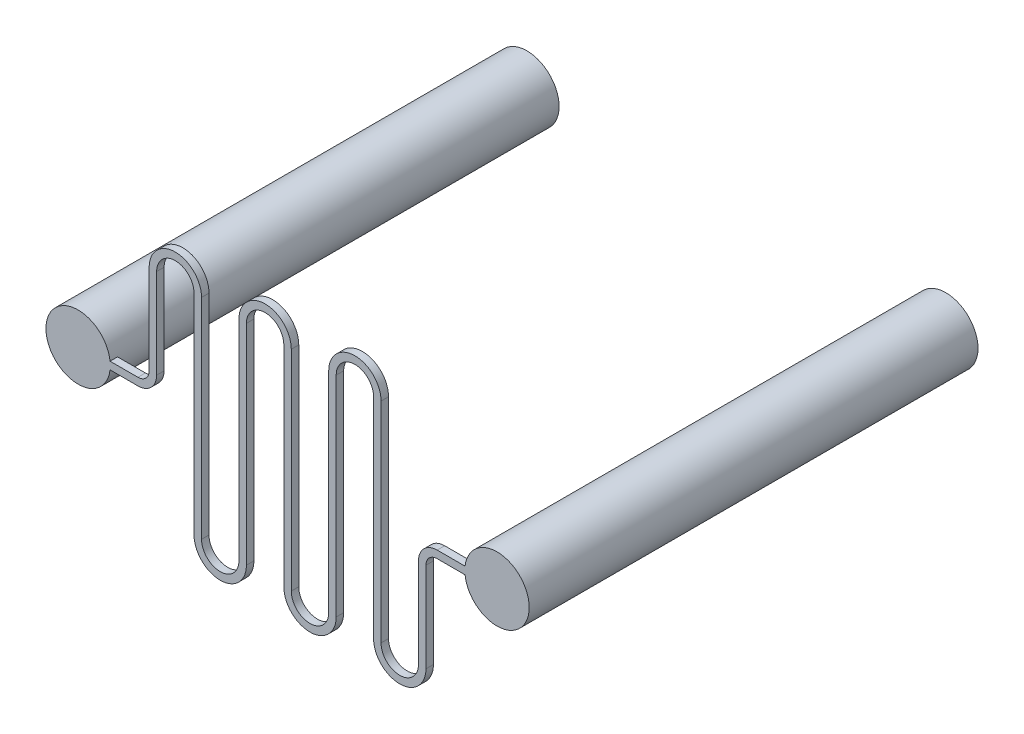
from build123d import *

# Parameters (mm, degrees)
BOSS_EXTRUDE1_DEPTH = 0.5
SKETCH3_W           = 2.15
SKETCH3_H           = 30
SKETCH4_W           = 2.15
SKETCH4_H           = 30
SKETCH5_R           = 1.75
CUT_EXTRUDE1_DEPTH  = 29


with BuildPart() as part:
    # Sketch2 → Boss-Extrude1 (new body)
    with BuildSketch(Plane.XY):
        with BuildLine():
            Line((-17.5, -0.25), (-13.5, -0.25))
            ThreePointArc((-13.5, -0.25), (-12.616116524, 0.116116524), (-12.25, 1))
            Line((-12.25, 1), (-12.25, 7))
            ThreePointArc((-12.25, 7), (-11, 8.25), (-9.75, 7))
            Line((-9.75, 7), (-9.75, 0))
            Line((-9.75, 0), (-9.75, -7))
            ThreePointArc((-9.75, -7), (-8, -8.75), (-6.25, -7))
            Line((-6.25, -7), (-6.25, 0))
            Line((-6.25, 0), (-6.25, 7))
            ThreePointArc((-6.25, 7), (-5, 8.25), (-3.75, 7))
            Line((-3.75, 7), (-3.75, 0))
            Line((-3.75, 0), (-3.75, -7))
            ThreePointArc((-3.75, -7), (-2, -8.75), (-0.25, -7))
            Line((-0.25, -7), (-0.25, 0))
            Line((-0.25, 0), (-0.25, 7))
            ThreePointArc((-0.25, 7), (1, 8.25), (2.25, 7))
            Line((2.25, 7), (2.25, 0))
            Line((2.25, 0), (2.25, -7))
            ThreePointArc((2.25, -7), (4, -8.75), (5.75, -7))
            Line((5.75, -7), (5.75, -1))
            ThreePointArc((5.75, -1), (5.969669914, -0.469669914), (6.5, -0.25))
            Line((6.5, -0.25), (10.5, -0.25))
            ThreePointArc((10.5, -0.25), (10.75, 0), (10.5, 0.25))
            Line((10.5, 0.25), (6.5, 0.25))
            ThreePointArc((6.5, 0.25), (5.616116524, -0.116116524), (5.25, -1))
            Line((5.25, -1), (5.25, -7))
            ThreePointArc((5.25, -7), (4, -8.25), (2.75, -7))
            Line((2.75, -7), (2.75, 0))
            Line((2.75, 0), (2.75, 7))
            ThreePointArc((2.75, 7), (1, 8.75), (-0.75, 7))
            Line((-0.75, 7), (-0.75, 0))
            Line((-0.75, 0), (-0.75, -7))
            ThreePointArc((-0.75, -7), (-2, -8.25), (-3.25, -7))
            Line((-3.25, -7), (-3.25, 0))
            Line((-3.25, 0), (-3.25, 7))
            ThreePointArc((-3.25, 7), (-5, 8.75), (-6.75, 7))
            Line((-6.75, 7), (-6.75, 0))
            Line((-6.75, 0), (-6.75, -7))
            ThreePointArc((-6.75, -7), (-8, -8.25), (-9.25, -7))
            Line((-9.25, -7), (-9.25, 0))
            Line((-9.25, 0), (-9.25, 7))
            ThreePointArc((-9.25, 7), (-11, 8.75), (-12.75, 7))
            Line((-12.75, 7), (-12.75, 1))
            ThreePointArc((-12.75, 1), (-12.969669914, 0.469669914), (-13.5, 0.25))
            Line((-13.5, 0.25), (-17.5, 0.25))
            ThreePointArc((-17.5, 0.25), (-17.75, 0), (-17.5, -0.25))
        make_face()
    extrude(amount=BOSS_EXTRUDE1_DEPTH)

    # Sketch3 → Revolve1 (revolve)
    with BuildSketch(Plane(origin=(0, 0, 0), x_dir=(-1, 0, 0), z_dir=(0, -1, 0)), mode=Mode.PRIVATE) as revolve1_sk:
        with Locations((18.575, 14.5)):
            Rectangle(SKETCH3_W, SKETCH3_H)
    revolve(revolve1_sk.sketch.rotate(Axis((-17.5, 0, 0.5), (0, 0, -1)), 180), axis=Axis((-17.5, 0, 0.5), (0, 0, -1)))

    # Sketch4 → Revolve2 (revolve)
    with BuildSketch(Plane(origin=(0, 0, 0), x_dir=(-1, 0, 0), z_dir=(0, -1, 0))):
        with Locations((-11.575, 14.5)):
            Rectangle(SKETCH4_W, SKETCH4_H)
    revolve(axis=Axis((10.5, 0, 0.5), (0, 0, -1)))

    # Sketch5 → Cut-Extrude1 (cut)
    with BuildSketch(Plane(origin=(0, 0, -29.5), x_dir=(-1, 0, 0), z_dir=(0, 0, -1))):
        with Locations((-10.5, 0)):
            Circle(SKETCH5_R)
        with Locations((17.5, 0)):
            Circle(SKETCH5_R)
    extrude(amount=-CUT_EXTRUDE1_DEPTH, mode=Mode.SUBTRACT)


solid = part.part
